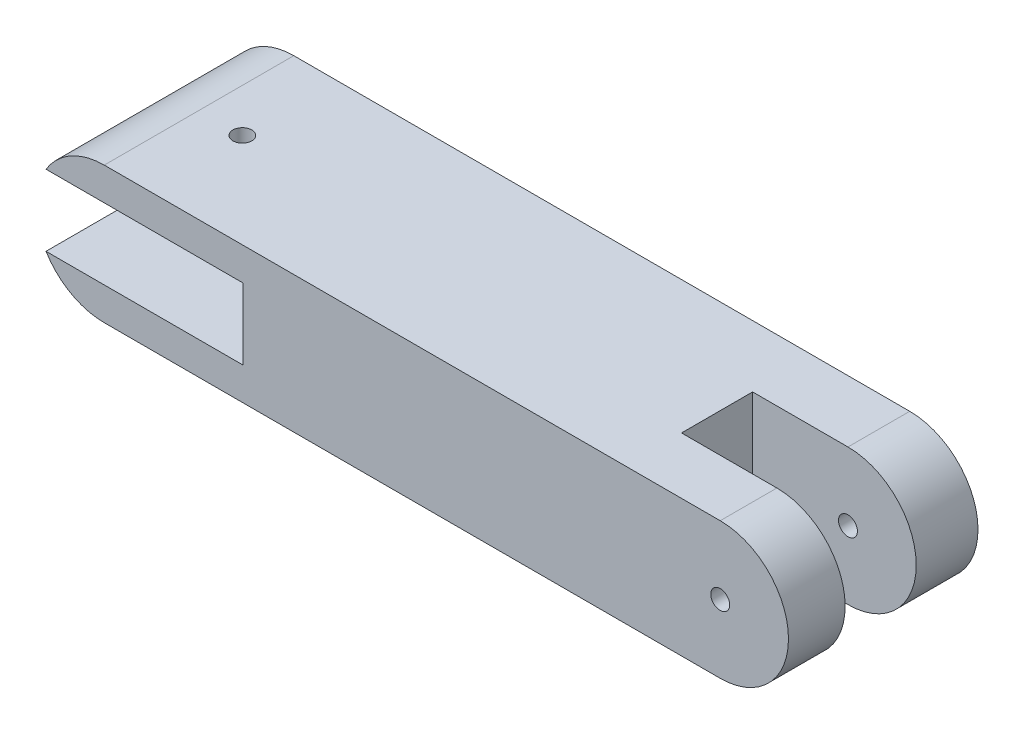
from build123d import *

# Parameters (mm, degrees)
RESSALTO_EXTRUS_O1_DEPTH = 40
ESBO_O2_R                = 2
CORTE_EXTRUS_O1_DEPTH    = 40
ESBO_O3_W                = 45.5934118
ESBO_O3_H                = 15
CORTE_EXTRUS_O2_DEPTH    = 40
ESBO_O4_R                = 2
CORTE_EXTRUS_O3_DEPTH    = 40
ESBO_O6_W                = 60.91322231
ESBO_O6_H                = 15
CORTE_EXTRUS_O5_DEPTH    = 62.5


with BuildPart() as part:
    # Esboço1 → Ressalto-extrusão1 (new body)
    with BuildSketch(Plane.XY):
        with BuildLine():
            Line((-56.556913458, 14.405805893), (73.443086542, 14.405805893))
            ThreePointArc((73.443086542, 14.405805893), (87.848892435, 0), (73.443086542, -14.405805893))
            Line((73.443086542, -14.405805893), (-56.556913458, -14.405805893))
            ThreePointArc((-56.556913458, -14.405805893), (-70.96271935, 0), (-56.556913458, 14.405805893))
        make_face()
    extrude(amount=RESSALTO_EXTRUS_O1_DEPTH)

    # Esboço2 → Corte-extrusão1 (cut, symmetric)
    with BuildSketch(Plane.XY.offset(40)):
        with Locations((73.443086542, 0)):
            Circle(ESBO_O2_R)
    extrude(amount=CORTE_EXTRUS_O1_DEPTH, both=True, mode=Mode.SUBTRACT)

    # Esboço3 → Corte-extrusão2 (cut, symmetric)
    with BuildSketch(Plane.XY.offset(40)):
        with Locations((-50.120588086, 0)):
            Rectangle(ESBO_O3_W, ESBO_O3_H)
    extrude(amount=CORTE_EXTRUS_O2_DEPTH, both=True, mode=Mode.SUBTRACT)

    # Esboço4 → Corte-extrusão3 (cut, symmetric)
    with BuildSketch(Plane(origin=(0, 14.405805893, 0), x_dir=(1, 0, 0), z_dir=(0, 1, 0))):
        with Locations(Location((-47.413412599, -20, 0), (0, 0, 270))):
            Circle(ESBO_O4_R)
    extrude(amount=CORTE_EXTRUS_O3_DEPTH, both=True, mode=Mode.SUBTRACT)

    # Esboço6 → Corte-extrusão5 (cut, symmetric)
    with BuildSketch(Plane(origin=(0, 14.405805893, 0), x_dir=(1, 0, 0), z_dir=(0, 1, 0))):
        with Locations((83.774809185, -20.540511229)):
            Rectangle(ESBO_O6_W, ESBO_O6_H)
    extrude(amount=CORTE_EXTRUS_O5_DEPTH, both=True, mode=Mode.SUBTRACT)


solid = part.part
